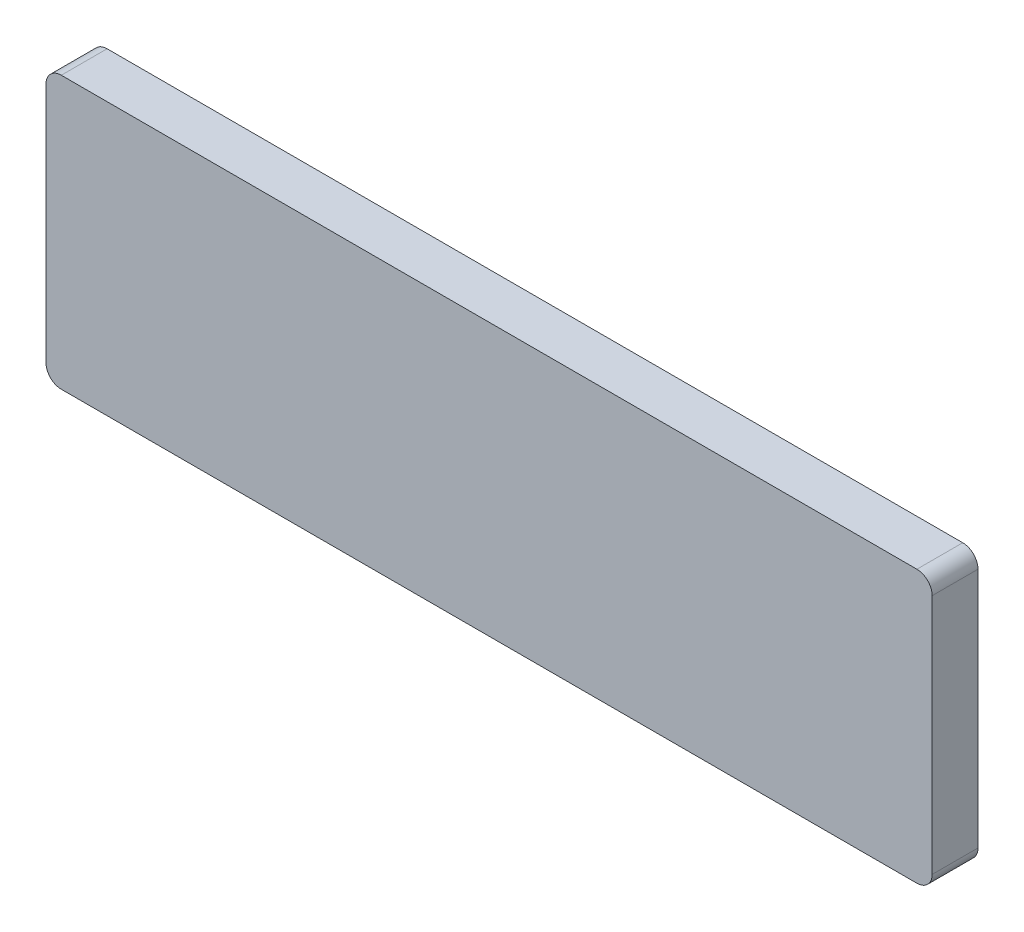
from build123d import *

# Parameters (mm, degrees)
BOSS_EXTRUDE1_DEPTH = 7.5


with BuildPart() as part:
    # Sketch1 → Boss-Extrude1 (new, symmetric)
    with BuildSketch(Plane.XY):
        with BuildLine():
            Line((-140, 44.5), (140, 44.5))
            ThreePointArc((140, 44.5), (143.535533906, 43.035533906), (145, 39.5))
            Line((145, 39.5), (145, -39.5))
            ThreePointArc((145, -39.5), (143.535533906, -43.035533906), (140, -44.5))
            Line((140, -44.5), (-140, -44.5))
            ThreePointArc((-140, -44.5), (-143.535533906, -43.035533906), (-145, -39.5))
            Line((-145, -39.5), (-145, 39.5))
            ThreePointArc((-145, 39.5), (-143.535533906, 43.035533906), (-140, 44.5))
        make_face()
    extrude(amount=BOSS_EXTRUDE1_DEPTH, both=True)


solid = part.part
